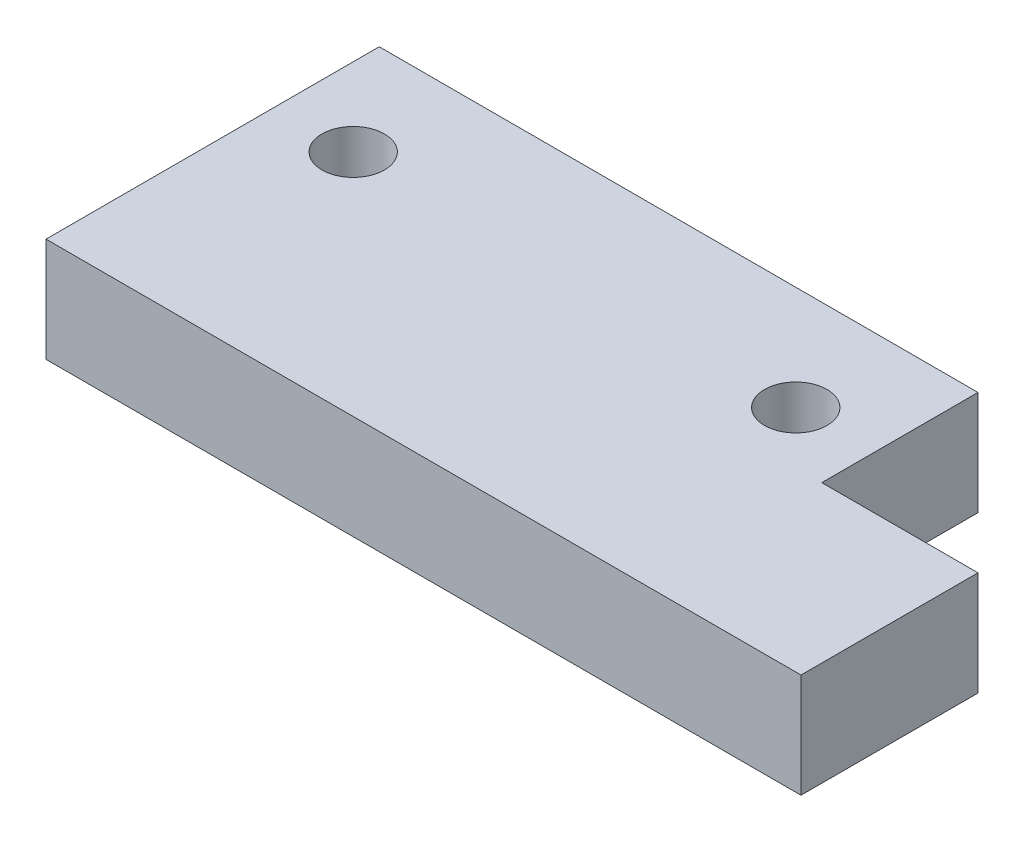
from build123d import *

# Parameters (mm, degrees)
SKETCH_1_W           = 35
SKETCH_1_H           = 20
EXTRUDE_1_DEPTH      = 4
SKETCH_3_W           = 29
SKETCH_3_H           = 7.2
CUT_EXTRUDE_4_DEPTH  = 5
SKETCH_4_W           = 6
SKETCH_4_H           = 6
CUT_EXTRUDE_5_DEPTH  = 5
SKETCH_5_R           = 1.2
CUT_EXTRUDE_6_DEPTH  = 41.509258201
SKETCH_6_R           = 2.2
CUT_EXTRUDE_7_DEPTH  = 2
CUT_EXTRUDE_START    = 4
SKETCH_7_R           = 2.2
CUT_EXTRUDE_8_DEPTH  = 2
SKETCH_8_W           = 40.267995894
SKETCH_8_H           = 24.754572762
CUT_EXTRUDE_9_DEPTH  = 41.509258201
SKETCH_11_W          = 6
SKETCH_11_H          = 20
CUT_EXTRUDE_11_DEPTH = 41.509258201


with BuildPart() as part:
    # 草圖1 → 填料-伸長1 (new body)
    with BuildSketch(Plane(origin=(0, 0, 0), x_dir=(1, 0, 0), z_dir=(0, 1, 0))):
        with Locations((17.5, 10)):
            Rectangle(SKETCH_1_W, SKETCH_1_H)
    extrude_1 = extrude(amount=EXTRUDE_1_DEPTH)

    # 草圖3 → 除料-伸長4 (cut)
    with BuildSketch(Plane(origin=(0, 0, 0), x_dir=(1, 0, 0), z_dir=(0, 1, 0))):
        with Locations((20.5, 3.6)):
            Rectangle(SKETCH_3_W, SKETCH_3_H)
    cut_extrude_4 = extrude(amount=CUT_EXTRUDE_4_DEPTH, mode=Mode.SUBTRACT)

    # 草圖4 → 除料-伸長5 (cut)
    with BuildSketch(Plane(origin=(0, 0, 0), x_dir=(1, 0, 0), z_dir=(0, 1, 0))):
        with Locations((32, 17)):
            Rectangle(SKETCH_4_W, SKETCH_4_H)
    cut_extrude_5 = extrude(amount=CUT_EXTRUDE_5_DEPTH, mode=Mode.SUBTRACT)

    # 草圖5 → 除料-伸長6 (cut, through all)
    with BuildSketch(Plane(origin=(0, 0, 0), x_dir=(1, 0, 0), z_dir=(0, 1, 0))):
        with Locations(Location((3, 16, 0), (0, 0, 270))):
            Circle(SKETCH_5_R)
        with Locations(Location((3, 4, 0), (0, 0, 270))):
            Circle(SKETCH_5_R)
        with Locations(Location((9, 16, 0), (0, 0, 270))):
            Circle(SKETCH_5_R)
        with Locations(Location((26, 16, 0), (0, 0, 270))):
            Circle(SKETCH_5_R)
    cut_extrude_6 = extrude(amount=CUT_EXTRUDE_6_DEPTH, mode=Mode.SUBTRACT)

    # 草圖6 → 除料-伸長7 (cut)
    with BuildSketch(Plane(origin=(0, 0, 0), x_dir=(1, 0, 0), z_dir=(0, 1, 0))):
        with Locations(Location((3, 16, 0), (0, 0, 270))):
            Circle(SKETCH_6_R)
        with Locations(Location((3, 4, 0), (0, 0, 270))):
            Circle(SKETCH_6_R)
    cut_extrude_7 = extrude(amount=CUT_EXTRUDE_7_DEPTH, mode=Mode.SUBTRACT)

    # 草圖7 → 除料-伸長8 (cut)
    with BuildSketch(Plane(origin=(0, 0, 0), x_dir=(1, 0, 0), z_dir=(0, 1, 0)).offset(CUT_EXTRUDE_START)):
        with Locations(Location((9, 16, 0), (0, 0, 90))):
            Circle(SKETCH_7_R)
        with Locations(Location((26, 16, 0), (0, 0, 90))):
            Circle(SKETCH_7_R)
    cut_extrude_8 = extrude(amount=-CUT_EXTRUDE_8_DEPTH, mode=Mode.SUBTRACT)

    # 鏡射1: 填料-伸長1, 除料-伸長4, 除料-伸長5, 除料-伸長6, 除料-伸長7, 除料-伸長8 across plane
    add(extrude_1.mirror(Plane.ZX))
    add(cut_extrude_4.mirror(Plane.ZX), mode=Mode.SUBTRACT)
    add(cut_extrude_5.mirror(Plane.ZX), mode=Mode.SUBTRACT)
    add(cut_extrude_6.mirror(Plane.ZX), mode=Mode.SUBTRACT)
    add(cut_extrude_7.mirror(Plane.ZX), mode=Mode.SUBTRACT)
    add(cut_extrude_8.mirror(Plane.ZX), mode=Mode.SUBTRACT)

    # 草圖8 → 除料-伸長9 (cut, through all)
    with BuildSketch(Plane(origin=(0, 0, 0), x_dir=(1, 0, 0), z_dir=(0, 1, 0))):
        with Locations((18.825302285, 8.624835494)):
            Rectangle(SKETCH_8_W, SKETCH_8_H)
    extrude(amount=CUT_EXTRUDE_9_DEPTH, mode=Mode.SUBTRACT)

    # 草圖11 → 除料-伸長11 (cut, through all)
    with BuildSketch(Plane(origin=(0, 0, 0), x_dir=(1, 0, 0), z_dir=(0, 1, 0))):
        with Locations((3, 10)):
            Rectangle(SKETCH_11_W, SKETCH_11_H)
    extrude(amount=-CUT_EXTRUDE_11_DEPTH, mode=Mode.SUBTRACT)


solid = part.part
